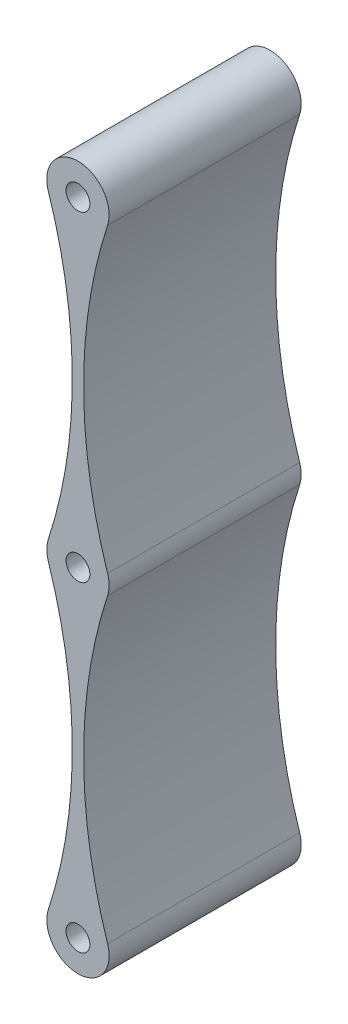
from build123d import *

# Parameters (mm, degrees)
BOSS_EXTRUDE1_DEPTH      = 16.95
BOSS_EXTRUDE1_DEPTH_BACK = 16.95
SKETCH4_R                = 2.1


with BuildPart() as part:
    # Sketch4 → Boss-Extrude1 (new, two sides: drawn at the far end of the back side and taken through both)
    with BuildSketch(Plane.XY.offset(-BOSS_EXTRUDE1_DEPTH_BACK)):
        with BuildLine():
            ThreePointArc((-5.228730789, -121.994018072), (0, -129.2), (5.228730789, -121.994018072))
            ThreePointArc((5.228730789, -121.994018072), (1, -95.4), (5.228730789, -68.805981928))
            ThreePointArc((5.228730789, -68.805981928), (5.5, -67.1), (5.228730789, -65.394018072))
            ThreePointArc((5.228730789, -65.394018072), (1, -38.8), (5.228730789, -12.205981928))
            ThreePointArc((5.228730789, -12.205981928), (0, -5), (-5.228730789, -12.205981928))
            ThreePointArc((-5.228730789, -12.205981928), (-1, -38.8), (-5.228730789, -65.394018072))
            ThreePointArc((-5.228730789, -65.394018072), (-5.5, -67.1), (-5.228730789, -68.805981928))
            ThreePointArc((-5.228730789, -68.805981928), (-1, -95.4), (-5.228730789, -121.994018072))
        make_face()
        with Locations((0, -123.7)):
            Circle(SKETCH4_R, mode=Mode.SUBTRACT)
        with Locations((0, -10.5)):
            Circle(SKETCH4_R, mode=Mode.SUBTRACT)
        with Locations((0, -67.1)):
            Circle(SKETCH4_R, mode=Mode.SUBTRACT)
    extrude(amount=BOSS_EXTRUDE1_DEPTH + BOSS_EXTRUDE1_DEPTH_BACK)


solid = part.part
